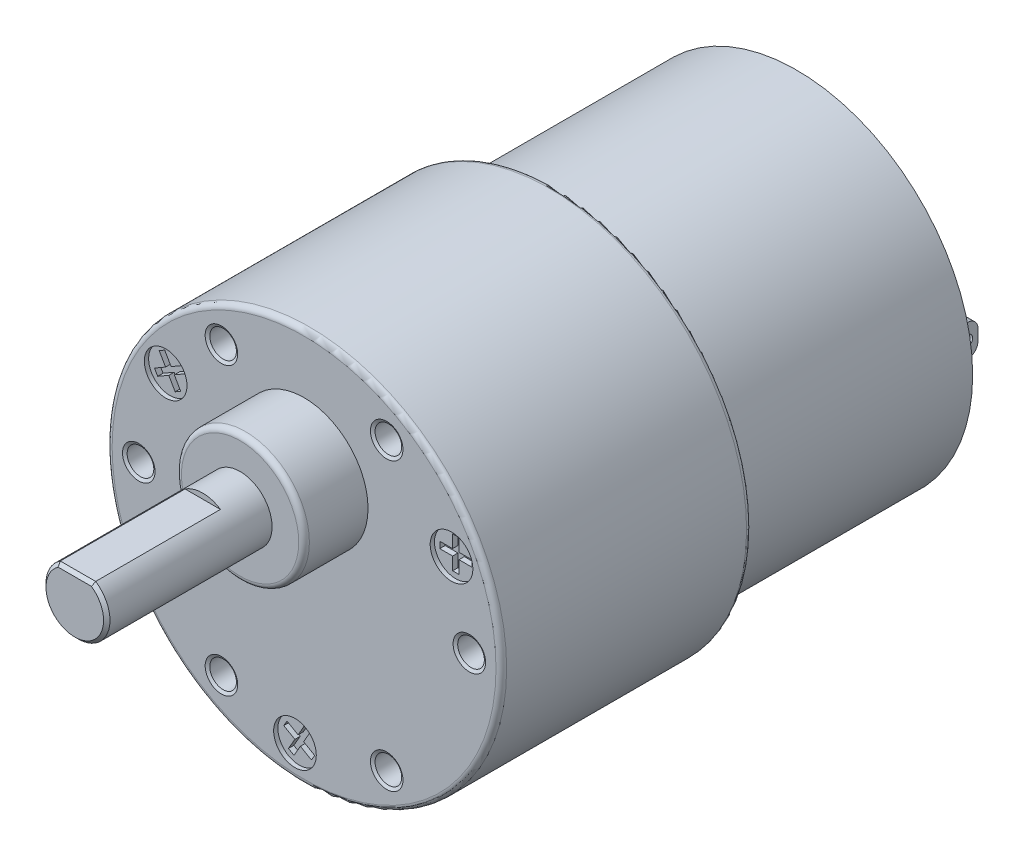
from build123d import *

# Parameters (mm, degrees)
SKETCH_1_R               = 16.5
EXTRUDE_1_DEPTH          = 22.7
SKETCH_2_R               = 18.5
EXTRUDE_2_DEPTH          = 23.5
SKETCH_3_R               = 6
EXTRUDE_3_DEPTH          = 6
SKETCH_4_R               = 3
EXTRUDE_4_DEPTH          = 15.5
CUT_EXTRUDE_START        = -12
CUT_EXTRUDE_1_DEPTH      = 12
SKETCH_6_W               = 1
SKETCH_6_H               = 3
EXTRUDE_5_DEPTH          = 3.5
SKETCH_7_R               = 1.5
EXTRUDE_6_DEPTH          = 1.5
SKETCH_8_R               = 0.5
CUT_EXTRUDE_2_DEPTH      = 78.133261308
FILLET_5_R               = 1
PATTERN_CIRCULAR_1_COUNT = 6
SKETCH_15_R              = 2
CUT_EXTRUDE_3_DEPTH      = 0.4
CUT_EXTRUDE_4_DEPTH      = 0.5
PATTERN_CIRCULAR_2_COUNT = 3
FILLET_6_R               = 0.5
SKETCH_18_R              = 16
CUT_EXTRUDE_5_DEPTH      = 0.6
FILLET_7_R               = 0.2
CHAMFER_1_SIZE           = 0.3


with BuildPart() as part:
    # 草图1 → 凸台-拉伸1 (new body)
    with BuildSketch(Plane.XY):
        Circle(SKETCH_1_R)
    extrude(amount=EXTRUDE_1_DEPTH)

    # 草图2 → 凸台-拉伸2 (add)
    with BuildSketch(Plane.XY.offset(22.7)):
        Circle(SKETCH_2_R)
    extrude(amount=EXTRUDE_2_DEPTH)

    # 草图3 → 凸台-拉伸3 (add)
    with BuildSketch(Plane.XY.offset(46.2)):
        with Locations((0, 7)):
            Circle(SKETCH_3_R)
    extrude(amount=EXTRUDE_3_DEPTH)

    # 草图4 → 凸台-拉伸4 (add)
    with BuildSketch(Plane.XY.offset(52.2)):
        with Locations((0, 7)):
            Circle(SKETCH_4_R)
    extrude(amount=EXTRUDE_4_DEPTH)

    # 草图5 → 切除-拉伸1 (cut)
    with BuildSketch(Plane.XY.offset(67.7).offset(CUT_EXTRUDE_START)):
        with BuildLine():
            Line((-1.658312395, 9.5), (1.658312395, 9.5))
            ThreePointArc((1.658312395, 9.5), (0, 10), (-1.658312395, 9.5))
        make_face()
    extrude(amount=CUT_EXTRUDE_1_DEPTH, mode=Mode.SUBTRACT)

    # 草图6 → 凸台-拉伸5 (add)
    with BuildSketch(Plane(origin=(0, 0, 0), x_dir=(-1, 0, 0), z_dir=(0, 0, -1))):
        with Locations((-13, 0)):
            Rectangle(SKETCH_6_W, SKETCH_6_H)
        with Locations((13, 0)):
            Rectangle(SKETCH_6_W, SKETCH_6_H)
    extrude(amount=EXTRUDE_5_DEPTH)

    # 草图7 → 凸台-拉伸6 (add)
    with BuildSketch(Plane(origin=(0, 0, 0), x_dir=(-1, 0, 0), z_dir=(0, 0, -1))):
        Circle(SKETCH_7_R)
    extrude(amount=EXTRUDE_6_DEPTH)

    # 草图8 → 切除-拉伸2 (cut, through all)
    with BuildSketch(Plane(origin=(13.5, 0, 0), x_dir=(0, 0, -1), z_dir=(1, 0, 0))):
        with Locations((2.5, 0)):
            Circle(SKETCH_8_R)
    extrude(amount=-CUT_EXTRUDE_2_DEPTH, mode=Mode.SUBTRACT)

    # 圆角5
    fillet_5_edges = [part.edges().sort_by_distance(p)[0] for p in [
        (-13, 1.5, -3.5),
        (-13, -1.5, -3.5),
        (13, 1.5, -3.5),
        (13, -1.5, -3.5),
    ]]
    fillet(fillet_5_edges, radius=FILLET_5_R)

    # 草图13 → M3 螺纹孔3 (revolve, cut)
    with BuildSketch(Plane(origin=(7.75, 13.423393759, 46.2), x_dir=(0, -1, 0), z_dir=(1, 0, 0))):
        Polygon((0, 0), (0, 7.251075774), (1.25, 6.5), (1.25, 0.158771324), (1.525, 0), align=None)
    hole_wizard_m3_3 = revolve(axis=Axis((7.75, 13.423393759, 52.55), (0, 0, -1)), mode=Mode.SUBTRACT)

    # 阵列(圆周)1: M3 螺纹孔3 ×6 about axis
    pattern_circular_1_axis = Axis((0, 0, -7.35), (0, 0, 1))
    for i in range(1, PATTERN_CIRCULAR_1_COUNT):
        add(hole_wizard_m3_3.rotate(pattern_circular_1_axis, i * 360 / PATTERN_CIRCULAR_1_COUNT), mode=Mode.SUBTRACT)

    # 草图15 → 切除-拉伸3 (cut)
    with BuildSketch(Plane.XY.offset(46.2)):
        with Locations((13.829316686, 7)):
            Circle(SKETCH_15_R)
    cut_extrude_3 = extrude(amount=-CUT_EXTRUDE_3_DEPTH, mode=Mode.SUBTRACT)

    # 草图17 → 切除-拉伸4 (cut)
    with BuildSketch(Plane.XY.offset(45.8)):
        Polygon((13.529316686, 5.5), (13.529316686, 6.7), (12.329316686, 6.7), (12.329316686, 7.3), (13.529316686, 7.3), (13.529316686, 8.5), (14.129316686, 8.5), (14.129316686, 7.3), (15.329316686, 7.3), (15.329316686, 6.7), (14.129316686, 6.7), (14.129316686, 5.5), align=None)
    cut_extrude_4 = extrude(amount=-CUT_EXTRUDE_4_DEPTH, mode=Mode.SUBTRACT)

    # 阵列(圆周)2: 切除-拉伸3, 切除-拉伸4 ×3 about axis
    pattern_circular_2_axis = Axis((0, 0, -7.35), (0, 0, 1))
    add([cut_extrude_3.rotate(pattern_circular_2_axis, i * 360 / PATTERN_CIRCULAR_2_COUNT) for i in range(1, PATTERN_CIRCULAR_2_COUNT)], mode=Mode.SUBTRACT)
    add([cut_extrude_4.rotate(pattern_circular_2_axis, i * 360 / PATTERN_CIRCULAR_2_COUNT) for i in range(1, PATTERN_CIRCULAR_2_COUNT)], mode=Mode.SUBTRACT)

    # 圆角6
    fillet_6_edges = [part.edges().sort_by_distance(p)[0] for p in [
        (-6, 7, 52.2),
        (-18.5, 0, 46.2),
        (-18.5, 0, 22.7),
    ]]
    fillet(fillet_6_edges, radius=FILLET_6_R)

    # 草图18 → 切除-拉伸5 (cut)
    with BuildSketch(Plane(origin=(0, 0, 0), x_dir=(-1, 0, 0), z_dir=(0, 0, -1))):
        Circle(SKETCH_18_R)
    extrude(amount=-CUT_EXTRUDE_5_DEPTH, mode=Mode.SUBTRACT)


with BuildPart() as cut_extrude_5_piece_1:
    # of the separate pieces the step leaves, piece 1, a body of its own (cut_extrude_5_pieces)
    add(part.part.solids().sort_by_distance((18, 0, 22.7))[0])

    # 倒角1
    chamfer_1_edges = [cut_extrude_5_piece_1.edges().sort_by_distance(p)[0] for p in [
        (0, 9.5, 67.7),
        (-1.418637165, 4.356617963, 67.7),
    ]]
    chamfer(chamfer_1_edges, length=CHAMFER_1_SIZE)


with BuildPart() as cut_extrude_5_piece_2:
    # of the separate pieces the step leaves, piece 2, a body of its own (cut_extrude_5_pieces)
    add(part.part.solids().sort_by_distance((-1.5, 0, 0))[0])

    # 圆角7
    fillet_7_edges = [cut_extrude_5_piece_2.edges().sort_by_distance(p)[0] for p in [
        (1.5, 0, -1.5),
    ]]
    fillet(fillet_7_edges, radius=FILLET_7_R)


with BuildPart() as cut_extrude_5_piece_3:
    # of the separate pieces the step leaves, piece 3, a body of its own (cut_extrude_5_pieces)
    add(part.part.solids().sort_by_distance((13.5, 1.5, -2.5))[0])


with BuildPart() as cut_extrude_5_piece_4:
    # of the separate pieces the step leaves, piece 4, a body of its own (cut_extrude_5_pieces)
    add(part.part.solids().sort_by_distance((-13.5, 1.5, -2.5))[0])


solid = Compound([cut_extrude_5_piece_1.part, cut_extrude_5_piece_2.part, cut_extrude_5_piece_3.part, cut_extrude_5_piece_4.part])
